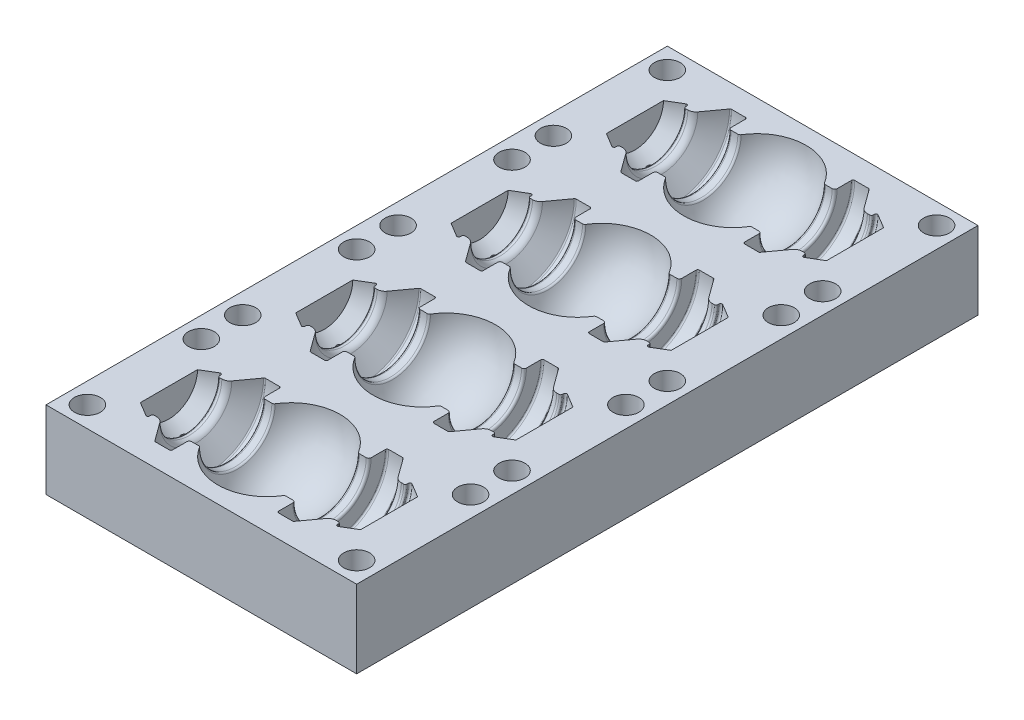
from build123d import *

# Parameters (mm, degrees)
SKETCH1_W                                = 38.1
SKETCH1_H                                = 19.05
BOSS_EXTRUDE1_DEPTH                      = 9.525
F_1_8_0_125_DIAMETER_HOLE1_AT_2_COUNT    = 2
F_1_8_0_125_DIAMETER_HOLE1_AT_2_PITCH    = 35.853609302
F_1_8_0_125_DIAMETER_HOLE1_AT_3_COUNT    = 2
F_1_8_0_125_DIAMETER_HOLE1_AT_3_PITCH    = 33.02
F_1_8_0_125_DIAMETER_HOLE1_AT_4_COUNT    = 2
F_1_8_0_125_DIAMETER_HOLE1_AT_4_PITCH    = 13.97
F_0_04688_DIAMETER_HOLE1_AT_2_COUNT      = 2
F_0_04688_DIAMETER_HOLE1_AT_2_PITCH      = 23.302899151
F_3_64_0_04688_DIAMETER_HOLE3_AT_2_COUNT = 2
F_3_64_0_04688_DIAMETER_HOLE3_AT_2_PITCH = 15.098155082
LPATTERN2_COUNT                          = 4
LPATTERN2_PITCH                          = 19.05
LPATTERN3_COUNT                          = 4
LPATTERN3_PITCH                          = 19.05


with BuildPart() as part:
    # Sketch1 → Boss-Extrude1 (new body)
    with BuildSketch(Plane(origin=(0, 0, 0), x_dir=(1, 0, 0), z_dir=(0, 1, 0))):
        Rectangle(SKETCH1_W, SKETCH1_H)
    boss_extrude1 = extrude(amount=-BOSS_EXTRUDE1_DEPTH)

    # Sketch2 → Cut-Revolve1 (revolve, cut)
    with BuildSketch(Plane(origin=(0, 0, 0), x_dir=(1, 0, 0), z_dir=(0, 1, 0))):
        with BuildLine():
            Line((-5.370288633, 4.5), (-6.2, 4.5))
            ThreePointArc((-6.2, 4.5), (-6.412132034, 4.587867966), (-6.5, 4.8))
            Line((-6.5, 4.8), (-6.5, 6.55))
            ThreePointArc((-6.5, 6.55), (-6.558578644, 6.691421356), (-6.7, 6.75))
            Line((-6.7, 6.75), (-8.398155082, 6.75))
            ThreePointArc((-8.398155082, 6.75), (-8.488910611, 6.728222989), (-8.559902299, 6.66763434))
            Line((-8.559902299, 6.66763434), (-10.200488507, 4.411828302))
            ThreePointArc((-10.200488507, 4.411828302), (-10.555446947, 4.108885053), (-11.009224592, 4))
            Line((-11.009224592, 4), (-11.3, 4))
            ThreePointArc((-11.3, 4), (-11.441421356, 4.058578644), (-11.5, 4.2))
            Line((-11.5, 4.2), (-11.5, 4.346761924))
            ThreePointArc((-11.5, 4.346761924), (-11.601460237, 4.520801906), (-11.802899151, 4.518260509))
            Line((-11.802899151, 4.518260509), (-13.5, 3.5))
            Line((-13.5, 3.5), (-13.5, 0))
            Line((-13.5, 0), (13.5, 0))
            Line((13.5, 0), (13.5, 3.5))
            Line((13.5, 3.5), (11.802899151, 4.518260509))
            ThreePointArc((11.802899151, 4.518260509), (11.601460237, 4.520801906), (11.5, 4.346761924))
            Line((11.5, 4.346761924), (11.5, 4.2))
            ThreePointArc((11.5, 4.2), (11.441421356, 4.058578644), (11.3, 4))
            Line((11.3, 4), (11.009224592, 4))
            ThreePointArc((11.009224592, 4), (10.555446947, 4.108885053), (10.200488507, 4.411828302))
            Line((10.200488507, 4.411828302), (8.559902299, 6.66763434))
            ThreePointArc((8.559902299, 6.66763434), (8.488910611, 6.728222989), (8.398155082, 6.75))
            Line((8.398155082, 6.75), (6.7, 6.75))
            ThreePointArc((6.7, 6.75), (6.558578644, 6.691421356), (6.5, 6.55))
            Line((6.5, 6.55), (6.5, 4.8))
            ThreePointArc((6.5, 4.8), (6.412132034, 4.587867966), (6.2, 4.5))
            Line((6.2, 4.5), (5.370288633, 4.5))
            ThreePointArc((5.370288633, 4.5), (5.223981013, 4.538095284), (5.114830928, 4.642706131))
            ThreePointArc((5.114830928, 4.642706131), (0, 7.5), (-5.114830928, 4.642706131))
            ThreePointArc((-5.114830928, 4.642706131), (-5.223981013, 4.538095284), (-5.370288633, 4.5))
        make_face()
    cut_revolve1 = revolve(axis=Axis((-13.5, 0, 0), (1, 0, 0)), mode=Mode.SUBTRACT)

    # Sketch6 → 1/8 (0.125) Diameter Hole1 (revolve, cut)
    with BuildSketch(Plane(origin=(-16.51, 0, -6.985), x_dir=(0, 0, 1), z_dir=(1, 0, 0))):
        Polygon((0, 0), (0, 7.303866233), (1.5875, 6.35), (1.5875, 0), align=None)
    f_1_8_0_125_diameter_hole1 = revolve(axis=Axis((-16.51, 6.35, -6.985), (0, -1, 0)), mode=Mode.SUBTRACT)

    # 1/8 (0.125) Diameter Hole1 at 2: 1/8 (0.125) Diameter Hole1 ×2
    with Locations(*[Vector(0.9209672510685588, 0, 0.389639990836698) * (i * F_1_8_0_125_DIAMETER_HOLE1_AT_2_PITCH) for i in range(1, F_1_8_0_125_DIAMETER_HOLE1_AT_2_COUNT)]):
        add(f_1_8_0_125_diameter_hole1, mode=Mode.SUBTRACT)

    # 1/8 (0.125) Diameter Hole1 at 3: 1/8 (0.125) Diameter Hole1 ×2
    with Locations(*[(i * F_1_8_0_125_DIAMETER_HOLE1_AT_3_PITCH, 0, 0) for i in range(1, F_1_8_0_125_DIAMETER_HOLE1_AT_3_COUNT)]):
        add(f_1_8_0_125_diameter_hole1, mode=Mode.SUBTRACT)

    # 1/8 (0.125) Diameter Hole1 at 4: 1/8 (0.125) Diameter Hole1 ×2
    with Locations(*[(0, 0, i * F_1_8_0_125_DIAMETER_HOLE1_AT_4_PITCH) for i in range(1, F_1_8_0_125_DIAMETER_HOLE1_AT_4_COUNT)]):
        add(f_1_8_0_125_diameter_hole1, mode=Mode.SUBTRACT)

    # Sketch11 → 0.04688_ Diameter Hole1 (revolve, cut)
    with BuildSketch(Plane(origin=(-11.651449576, -9.525, 0), x_dir=(0, 0, -1), z_dir=(1, 0, 0))):
        Polygon((0, 0), (0, 5.310737992), (0.595376, 4.953), (0.595376, 0), align=None)
    f_0_04688_diameter_hole1 = revolve(axis=Axis((-11.651449576, -15.875, 0), (0, 1, 0)), mode=Mode.SUBTRACT)

    # 0.04688_ Diameter Hole1 at 2: 0.04688_ Diameter Hole1 ×2
    with Locations(*[(i * F_0_04688_DIAMETER_HOLE1_AT_2_PITCH, 0, 0) for i in range(1, F_0_04688_DIAMETER_HOLE1_AT_2_COUNT)]):
        add(f_0_04688_diameter_hole1, mode=Mode.SUBTRACT)

    # Sketch14 → 7/64 (0.10938) Diameter Hole1 (revolve, cut)
    with BuildSketch(Plane(origin=(0, -9.525, 6.35), x_dir=(0, 0, -1), z_dir=(1, 0, 0))):
        Polygon((0, 0), (0, 3.247671108), (1.389126, 2.413), (1.389126, 0), align=None)
    f_7_64_0_10938_diameter_hole1 = revolve(axis=Axis((0, -15.875, 6.35), (0, 1, 0)), mode=Mode.SUBTRACT)

    # Sketch16 → 3/64 (0.04688) Diameter Hole2 (revolve, cut)
    with BuildSketch(Plane(origin=(0, -9.525, 0), x_dir=(0, 0, -1), z_dir=(1, 0, 0))):
        Polygon((0, 0), (0, 2.262737992), (0.595376, 1.905), (0.595376, 0), align=None)
    f_3_64_0_04688_diameter_hole2 = revolve(axis=Axis((0, -15.875, 0), (0, 1, 0)), mode=Mode.SUBTRACT)

    # Sketch18 → 3/64 (0.04688) Diameter Hole3 (revolve, cut)
    with BuildSketch(Plane(origin=(7.549077541, -9.525, 0), x_dir=(0, 0, -1), z_dir=(1, 0, 0))):
        Polygon((0, 0), (0, 3.024737992), (0.595376, 2.667), (0.595376, 0), align=None)
    f_3_64_0_04688_diameter_hole3 = revolve(axis=Axis((7.549077541, -15.875, 0), (0, 1, 0)), mode=Mode.SUBTRACT)

    # 3/64 (0.04688) Diameter Hole3 at 2: 3/64 (0.04688) Diameter Hole3 ×2
    with Locations(*[(-i * F_3_64_0_04688_DIAMETER_HOLE3_AT_2_PITCH, 0, 0) for i in range(1, F_3_64_0_04688_DIAMETER_HOLE3_AT_2_COUNT)]):
        add(f_3_64_0_04688_diameter_hole3, mode=Mode.SUBTRACT)

    # Sketch20 → 1/16 (0.0625) Diameter Hole1 (revolve, cut)
    with BuildSketch(Plane(origin=(0, -9.525, 6.35), x_dir=(0, 0, -1), z_dir=(1, 0, 0))):
        Polygon((0, 0), (0, 5.683933116), (0.79375, 5.207), (0.79375, 0), align=None)
    f_1_16_0_0625_diameter_hole1 = revolve(axis=Axis((0, -15.875, 6.35), (0, 1, 0)), mode=Mode.SUBTRACT)

    # LPattern2: Boss-Extrude1, Cut-Revolve1, 1/8 (0.125) Diameter Hole1 ×4
    with Locations(*[(0, 0, -i * LPATTERN2_PITCH) for i in range(1, LPATTERN2_COUNT)]):
        add(boss_extrude1)
        add(cut_revolve1, mode=Mode.SUBTRACT)
        add(f_1_8_0_125_diameter_hole1, mode=Mode.SUBTRACT)

    # LPattern2 copy 1 sketch → LPattern2 copy 1 (revolve, cut)
    with BuildSketch(Plane(origin=(16.51, 0, -12.065), x_dir=(0, 0, 1), z_dir=(1, 0, 0))):
        Polygon((0, 0), (0, 7.303866233), (1.5875, 6.35), (1.5875, 0), align=None)
    revolve(axis=Axis((16.51, 6.35, -12.065), (0, -1, 0)), mode=Mode.SUBTRACT)

    # LPattern2 copy 2 sketch → LPattern2 copy 2 (revolve, cut)
    with BuildSketch(Plane(origin=(16.51, 0, -31.115), x_dir=(0, 0, 1), z_dir=(1, 0, 0))):
        Polygon((0, 0), (0, 7.303866233), (1.5875, 6.35), (1.5875, 0), align=None)
    revolve(axis=Axis((16.51, 6.35, -31.115), (0, -1, 0)), mode=Mode.SUBTRACT)

    # LPattern2 copy 3 sketch → LPattern2 copy 3 (revolve, cut)
    with BuildSketch(Plane(origin=(16.51, 0, -50.165), x_dir=(0, 0, 1), z_dir=(1, 0, 0))):
        Polygon((0, 0), (0, 7.303866233), (1.5875, 6.35), (1.5875, 0), align=None)
    revolve(axis=Axis((16.51, 6.35, -50.165), (0, -1, 0)), mode=Mode.SUBTRACT)

    # LPattern2 copy 4 sketch → LPattern2 copy 4 (revolve, cut)
    with BuildSketch(Plane(origin=(16.51, 0, -26.035), x_dir=(0, 0, 1), z_dir=(1, 0, 0))):
        Polygon((0, 0), (0, 7.303866233), (1.5875, 6.35), (1.5875, 0), align=None)
    revolve(axis=Axis((16.51, 6.35, -26.035), (0, -1, 0)), mode=Mode.SUBTRACT)

    # LPattern2 copy 5 sketch → LPattern2 copy 5 (revolve, cut)
    with BuildSketch(Plane(origin=(16.51, 0, -45.085), x_dir=(0, 0, 1), z_dir=(1, 0, 0))):
        Polygon((0, 0), (0, 7.303866233), (1.5875, 6.35), (1.5875, 0), align=None)
    revolve(axis=Axis((16.51, 6.35, -45.085), (0, -1, 0)), mode=Mode.SUBTRACT)

    # LPattern2 copy 6 sketch → LPattern2 copy 6 (revolve, cut)
    with BuildSketch(Plane(origin=(16.51, 0, -64.135), x_dir=(0, 0, 1), z_dir=(1, 0, 0))):
        Polygon((0, 0), (0, 7.303866233), (1.5875, 6.35), (1.5875, 0), align=None)
    revolve(axis=Axis((16.51, 6.35, -64.135), (0, -1, 0)), mode=Mode.SUBTRACT)

    # LPattern2 copy 7 sketch → LPattern2 copy 7 (revolve, cut)
    with BuildSketch(Plane(origin=(-16.51, 0, -12.065), x_dir=(0, 0, 1), z_dir=(1, 0, 0))):
        Polygon((0, 0), (0, 7.303866233), (1.5875, 6.35), (1.5875, 0), align=None)
    revolve(axis=Axis((-16.51, 6.35, -12.065), (0, -1, 0)), mode=Mode.SUBTRACT)

    # LPattern2 copy 8 sketch → LPattern2 copy 8 (revolve, cut)
    with BuildSketch(Plane(origin=(-16.51, 0, -31.115), x_dir=(0, 0, 1), z_dir=(1, 0, 0))):
        Polygon((0, 0), (0, 7.303866233), (1.5875, 6.35), (1.5875, 0), align=None)
    revolve(axis=Axis((-16.51, 6.35, -31.115), (0, -1, 0)), mode=Mode.SUBTRACT)

    # LPattern2 copy 9 sketch → LPattern2 copy 9 (revolve, cut)
    with BuildSketch(Plane(origin=(-16.51, 0, -50.165), x_dir=(0, 0, 1), z_dir=(1, 0, 0))):
        Polygon((0, 0), (0, 7.303866233), (1.5875, 6.35), (1.5875, 0), align=None)
    revolve(axis=Axis((-16.51, 6.35, -50.165), (0, -1, 0)), mode=Mode.SUBTRACT)

    # LPattern3: 0.04688_ Diameter Hole1, 7/64 (0.10938) Diameter Hole1, 3/64 (0.04688) Diameter Hole2, 3/64 (0.04688) Diameter Hole3, 1/16 (0.0625) Diameter Hole1 ×4
    with Locations(*[(0, 0, -i * LPATTERN3_PITCH) for i in range(1, LPATTERN3_COUNT)]):
        add(f_0_04688_diameter_hole1, mode=Mode.SUBTRACT)
        add(f_7_64_0_10938_diameter_hole1, mode=Mode.SUBTRACT)
        add(f_3_64_0_04688_diameter_hole2, mode=Mode.SUBTRACT)
        add(f_3_64_0_04688_diameter_hole3, mode=Mode.SUBTRACT)
        add(f_1_16_0_0625_diameter_hole1, mode=Mode.SUBTRACT)

    # LPattern3 copy 1 sketch → LPattern3 copy 1 (revolve, cut)
    with BuildSketch(Plane(origin=(11.651449576, -9.525, -19.05), x_dir=(0, 0, -1), z_dir=(1, 0, 0))):
        Polygon((0, 0), (0, 5.310737992), (0.595376, 4.953), (0.595376, 0), align=None)
    revolve(axis=Axis((11.651449576, -15.875, -19.05), (0, 1, 0)), mode=Mode.SUBTRACT)

    # LPattern3 copy 2 sketch → LPattern3 copy 2 (revolve, cut)
    with BuildSketch(Plane(origin=(11.651449576, -9.525, -38.1), x_dir=(0, 0, -1), z_dir=(1, 0, 0))):
        Polygon((0, 0), (0, 5.310737992), (0.595376, 4.953), (0.595376, 0), align=None)
    revolve(axis=Axis((11.651449576, -15.875, -38.1), (0, 1, 0)), mode=Mode.SUBTRACT)

    # LPattern3 copy 3 sketch → LPattern3 copy 3 (revolve, cut)
    with BuildSketch(Plane(origin=(11.651449576, -9.525, -57.15), x_dir=(0, 0, -1), z_dir=(1, 0, 0))):
        Polygon((0, 0), (0, 5.310737992), (0.595376, 4.953), (0.595376, 0), align=None)
    revolve(axis=Axis((11.651449576, -15.875, -57.15), (0, 1, 0)), mode=Mode.SUBTRACT)

    # LPattern3 copy 4 sketch → LPattern3 copy 4 (revolve, cut)
    with BuildSketch(Plane(origin=(-7.549077541, -9.525, -19.05), x_dir=(0, 0, -1), z_dir=(1, 0, 0))):
        Polygon((0, 0), (0, 3.024737992), (0.595376, 2.667), (0.595376, 0), align=None)
    revolve(axis=Axis((-7.549077541, -15.875, -19.05), (0, 1, 0)), mode=Mode.SUBTRACT)

    # LPattern3 copy 5 sketch → LPattern3 copy 5 (revolve, cut)
    with BuildSketch(Plane(origin=(-7.549077541, -9.525, -38.1), x_dir=(0, 0, -1), z_dir=(1, 0, 0))):
        Polygon((0, 0), (0, 3.024737992), (0.595376, 2.667), (0.595376, 0), align=None)
    revolve(axis=Axis((-7.549077541, -15.875, -38.1), (0, 1, 0)), mode=Mode.SUBTRACT)

    # LPattern3 copy 6 sketch → LPattern3 copy 6 (revolve, cut)
    with BuildSketch(Plane(origin=(-7.549077541, -9.525, -57.15), x_dir=(0, 0, -1), z_dir=(1, 0, 0))):
        Polygon((0, 0), (0, 3.024737992), (0.595376, 2.667), (0.595376, 0), align=None)
    revolve(axis=Axis((-7.549077541, -15.875, -57.15), (0, 1, 0)), mode=Mode.SUBTRACT)


solid = part.part
